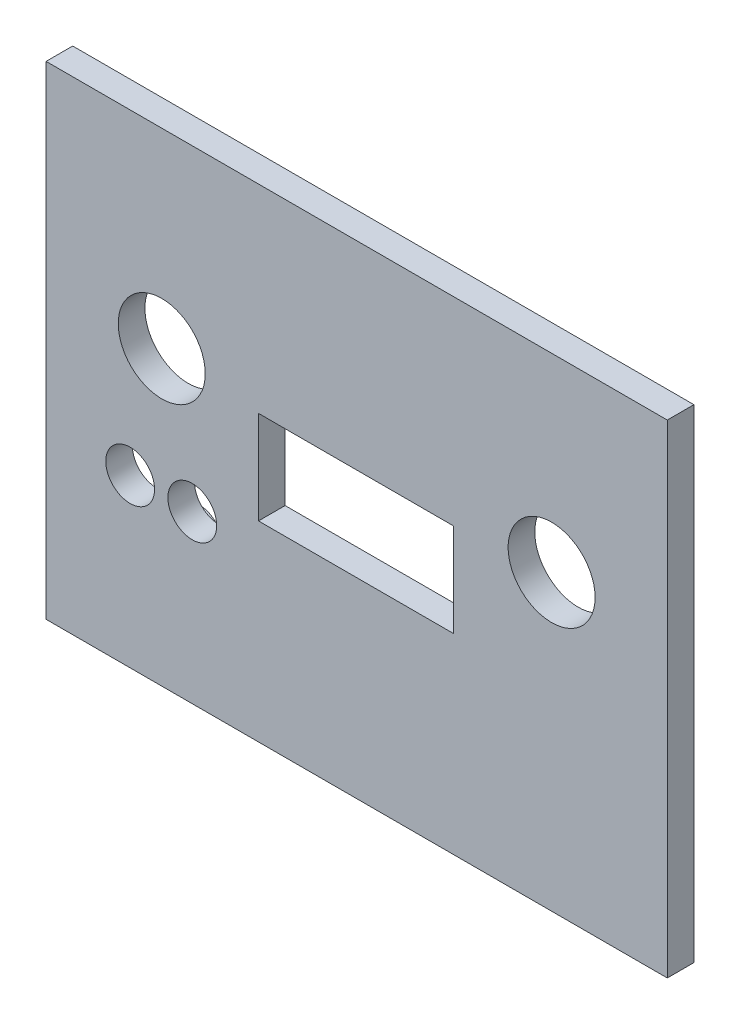
from build123d import *

# Parameters (mm, degrees)
SZKIC1_W                    = 70.000011125
SZKIC1_H                    = 54.450044047
SZKIC1_R                    = 4.901215244
SZKIC1_R_2                  = 2.75
SZKIC1_W_2                  = 22
SZKIC1_H_2                  = 10.5
DODANIE_WYCI_GNI_CIE2_DEPTH = 3
SZKIC3_R                    = 2.5
DODANIE_WYCI_GNI_CIE3_DEPTH = 5.3
SZKIC5_R                    = 1.25
WYTNIJ_WYCI_GNI_CIE1_DEPTH  = 5
SZKIC6_R                    = 0.8
DODANIE_WYCI_GNI_CIE4_DEPTH = 5


with BuildPart() as part:
    # Szkic1 → Dodanie-wyciągnięcie2 (new body)
    with BuildSketch(Plane.XY):
        with Locations((29.999994437, 22.225000357)):
            Rectangle(SZKIC1_W, SZKIC1_H)
        with Locations((8.033600802, 27.9335383)):
            Circle(SZKIC1_R, mode=Mode.SUBTRACT)
        with Locations((51.966399076, 28.066461662)):
            Circle(SZKIC1_R, mode=Mode.SUBTRACT)
        with Locations((4.47500206, 13.790057549)):
            Circle(SZKIC1_R_2, mode=Mode.SUBTRACT)
        with Locations((11.475021134, 13.75003756)):
            Circle(SZKIC1_R_2, mode=Mode.SUBTRACT)
        with Locations((29.933998796, 21.819981485)):
            Rectangle(SZKIC1_W_2, SZKIC1_H_2, mode=Mode.SUBTRACT)
    extrude(amount=DODANIE_WYCI_GNI_CIE2_DEPTH)

    # Szkic3 → Dodanie-wyciągnięcie3 (add)
    with BuildSketch(Plane(origin=(0, 0, 0), x_dir=(-1, 0, 0), z_dir=(0, 0, -1))):
        with Locations((-55.99999976, 40.50000028)):
            Circle(SZKIC3_R)
        with Locations((-3.99999962, 40.50000028)):
            Circle(SZKIC3_R)
        with Locations((-55.99999976, 3.99999962)):
            Circle(SZKIC3_R)
        with Locations((-3.99999962, 3.99999962)):
            Circle(SZKIC3_R)
    extrude(amount=DODANIE_WYCI_GNI_CIE3_DEPTH)

    # Szkic5 → Wytnij-wyciągnięcie1 (cut)
    with BuildSketch(Plane(origin=(0, 0, -5.3), x_dir=(-1, 0, 0), z_dir=(0, 0, -1))):
        with Locations((-55.99999976, 40.50000028)):
            Circle(SZKIC5_R)
        with Locations((-3.99999962, 40.50000028)):
            Circle(SZKIC5_R)
        with Locations((-55.99999976, 3.99999962)):
            Circle(SZKIC5_R)
        with Locations((-3.99999962, 3.99999962)):
            Circle(SZKIC5_R)
    extrude(amount=-WYTNIJ_WYCI_GNI_CIE1_DEPTH, mode=Mode.SUBTRACT)

    # Szkic6 → Dodanie-wyciągnięcie4 (add)
    with BuildSketch(Plane(origin=(0, 0, 0), x_dir=(-1, 0, 0), z_dir=(0, 0, -1))):
        with Locations((-41.583998796, 31.969981485)):
            Circle(SZKIC6_R)
        with Locations((-18.283998796, 31.969981485)):
            Circle(SZKIC6_R)
        with Locations((-41.583998796, 8.169981485)):
            Circle(SZKIC6_R)
        with Locations((-18.283998796, 8.169981485)):
            Circle(SZKIC6_R)
    extrude(amount=DODANIE_WYCI_GNI_CIE4_DEPTH)


solid = part.part
